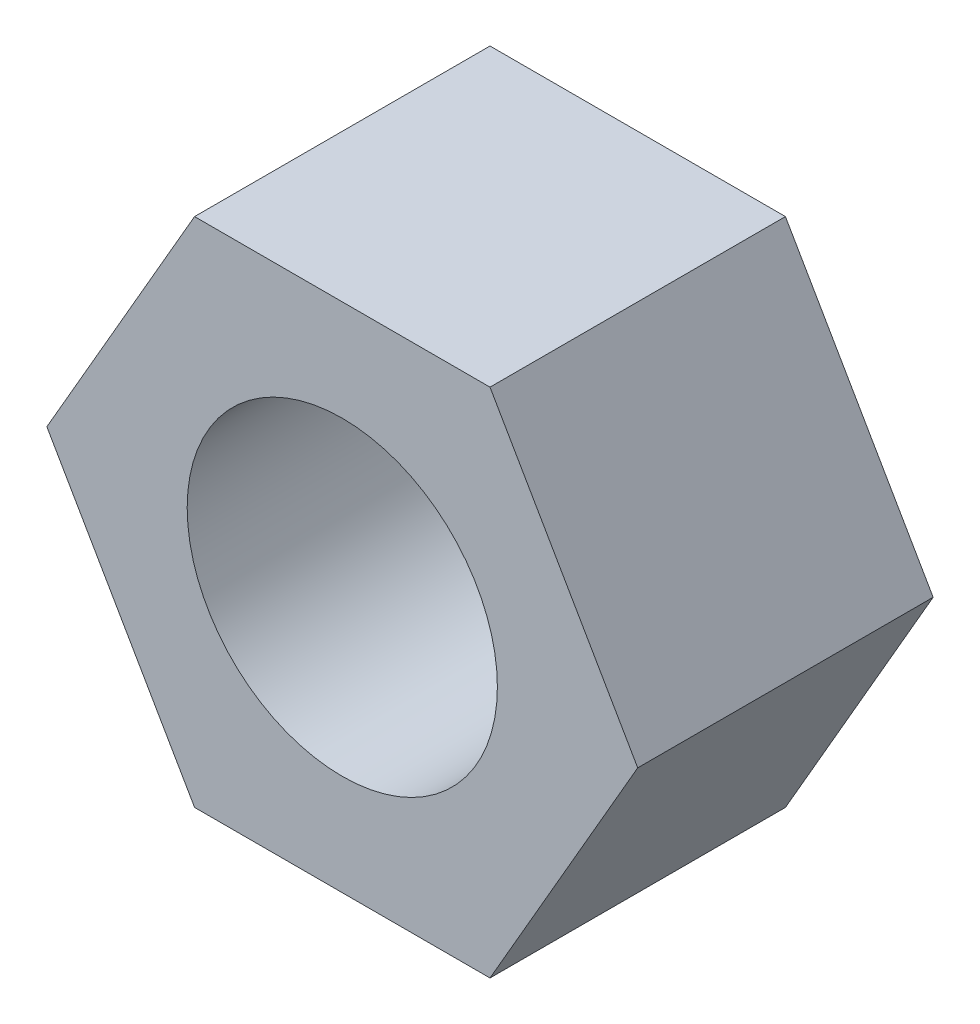
from build123d import *

# Parameters (mm, degrees)
EXTRUDE_1_DEPTH = 4
M5X0_8_2_D      = 4.2


with BuildPart() as part:
    # 草图2 → 拉伸1 (new body)
    with BuildSketch(Plane.XY):
        Polygon((2, -3.464101615), (4, 0), (2, 3.464101615), (-2, 3.464101615), (-4, 0), (-2, -3.464101615), align=None)
    extrude(amount=EXTRUDE_1_DEPTH)

    # M5x0.8 螺纹孔2 (through all)
    with Locations(Plane(origin=(0, 0, 0), x_dir=(-1, 0, 0), z_dir=(0, 0, -1))):
        with Locations((0, 0)):
            Hole(M5X0_8_2_D / 2)


solid = part.part
